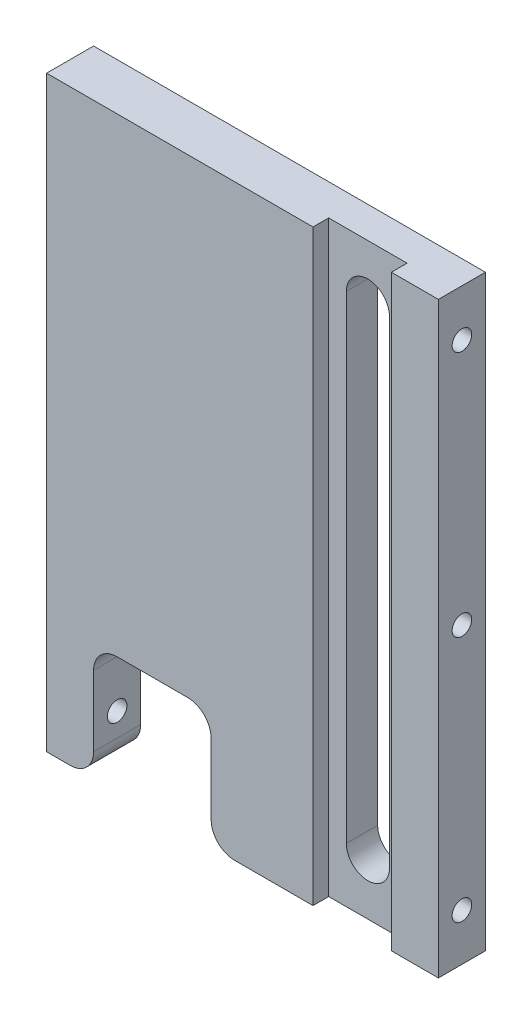
from build123d import *

# Parameters (mm, degrees)
SKETCH_1_W          = 50
SKETCH_1_H          = 75
EXTRUDE_1_DEPTH     = 6
CUT_EXTRUDE_1_DEPTH = 46.467021015
M3X0_51_AT_2_COUNT  = 2
M3X0_51_AT_2_PITCH  = 31.5
M3X0_51_AT_3_COUNT  = 2
M3X0_51_AT_3_PITCH  = 63
SKETCH_6_W          = 10
SKETCH_6_H          = 75
CUT_EXTRUDE_2_DEPTH = 2
SKETCH_7_W          = 15
SKETCH_7_H          = 15
CUT_EXTRUDE_3_DEPTH = 46.467021015
FILLET_1_R          = 3


with BuildPart() as part:
    # Эскиз1 → Бобышка-Вытянуть1 (new body)
    with BuildSketch(Plane.XY):
        Rectangle(SKETCH_1_W, SKETCH_1_H)
    extrude(amount=EXTRUDE_1_DEPTH)

    # Эскиз2 → Вырез-Вытянуть1 (cut, through all)
    with BuildSketch(Plane.XY.offset(6)):
        with BuildLine():
            Line((16.75, 30.5), (16.75, -30.5))
            ThreePointArc((16.75, -30.5), (14, -33.25), (11.25, -30.5))
            Line((11.25, -30.5), (11.25, 30.5))
            ThreePointArc((11.25, 30.5), (14, 33.25), (16.75, 30.5))
        make_face()
    extrude(amount=-CUT_EXTRUDE_1_DEPTH, mode=Mode.SUBTRACT)

    # Эскиз4 → Отверстие обработанное метчиком M3x0.51 (revolve, cut)
    with BuildSketch(Plane(origin=(-25, 31.5, 3), x_dir=(0, 0, 1), z_dir=(0, 1, 0))):
        Polygon((0, 0), (0, 6.751075774), (1.25, 6), (1.25, 0), align=None)
    m3x0_51 = revolve(axis=Axis((-31.35, 31.5, 3), (1, 0, 0)), mode=Mode.SUBTRACT)

    # Отверстие обработанное метчиком M3x0.51 at 2: Отверстие обработанное метчиком M3x0.51 ×2
    with Locations(*[(0, -i * M3X0_51_AT_2_PITCH, 0) for i in range(1, M3X0_51_AT_2_COUNT)]):
        add(m3x0_51, mode=Mode.SUBTRACT)

    # Отверстие обработанное метчиком M3x0.51 at 3: Отверстие обработанное метчиком M3x0.51 ×2
    with Locations(*[(0, -i * M3X0_51_AT_3_PITCH, 0) for i in range(1, M3X0_51_AT_3_COUNT)]):
        add(m3x0_51, mode=Mode.SUBTRACT)

    # Зеркальное отражение1: Отверстие обработанное метчиком M3x0.51 across plane
    add(m3x0_51.mirror(Plane.ZY), mode=Mode.SUBTRACT)

    # Зеркальное отражение1 copy 1 sketch → Зеркальное отражение1 copy 1 (revolve, cut)
    with BuildSketch(Plane(origin=(25, 0, 3), x_dir=(0, 0, 1), z_dir=(0, 1, 0))):
        Polygon((0, 0), (0, -6.751075774), (1.25, -6), (1.25, 0), align=None)
    revolve(axis=Axis((31.35, 0, 3), (1, 0, 0)), mode=Mode.SUBTRACT)

    # Зеркальное отражение1 copy 2 sketch → Зеркальное отражение1 copy 2 (revolve, cut)
    with BuildSketch(Plane(origin=(25, -31.5, 3), x_dir=(0, 0, 1), z_dir=(0, 1, 0))):
        Polygon((0, 0), (0, -6.751075774), (1.25, -6), (1.25, 0), align=None)
    revolve(axis=Axis((31.35, -31.5, 3), (1, 0, 0)), mode=Mode.SUBTRACT)

    # Эскиз6 → Вырез-Вытянуть2 (cut)
    with BuildSketch(Plane.XY.offset(6)):
        with Locations((14, 0)):
            Rectangle(SKETCH_6_W, SKETCH_6_H)
    extrude(amount=-CUT_EXTRUDE_2_DEPTH, mode=Mode.SUBTRACT)

    # Эскиз7 → Вырез-Вытянуть3 (cut, through all)
    with BuildSketch(Plane.XY.offset(6)):
        with Locations((-11.5, -30)):
            Rectangle(SKETCH_7_W, SKETCH_7_H)
    extrude(amount=-CUT_EXTRUDE_3_DEPTH, mode=Mode.SUBTRACT)

    # Скругление1
    fillet_1_edges = [part.edges().sort_by_distance(p)[0] for p in [
        (-19, -37.5, 3),
        (-4, -22.5, 3),
        (-4, -37.5, 3),
        (-19, -22.5, 3),
    ]]
    fillet(fillet_1_edges, radius=FILLET_1_R)


solid = part.part
